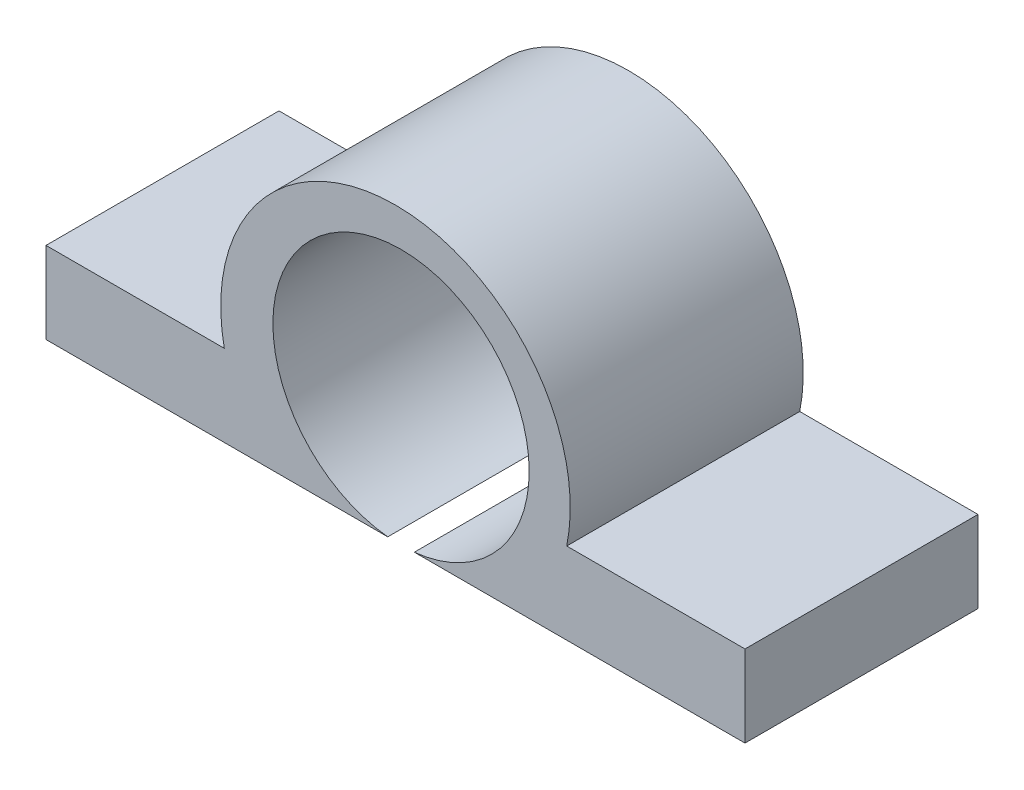
from build123d import *

# Parameters (mm, degrees)
BOSS_EXTRUDE1_DEPTH = 20
SKETCH3_R           = 11
CUT_EXTRUDE1_DEPTH  = 42.979161497


with BuildPart() as part:
    # Sketch1 → Boss-Extrude1 (new body)
    with BuildSketch(Plane.XY):
        with BuildLine():
            Line((14.696938457, 3.5), (30, 3.5))
            Line((30, 3.5), (30, -3.5))
            Line((30, -3.5), (-30, -3.5))
            Line((-30, -3.5), (-30, 3.5))
            Line((-30, 3.5), (-14.696938457, 3.5))
            ThreePointArc((-14.696938457, 3.5), (0, 21.5), (14.696938457, 3.5))
        make_face()
    extrude(amount=BOSS_EXTRUDE1_DEPTH)

    # Sketch3 → Cut-Extrude1 (cut, through all)
    with BuildSketch(Plane.XY.offset(20)):
        with Locations((0.475039653, 7.440620043)):
            Circle(SKETCH3_R)
    extrude(amount=-CUT_EXTRUDE1_DEPTH, mode=Mode.SUBTRACT)


solid = part.part
